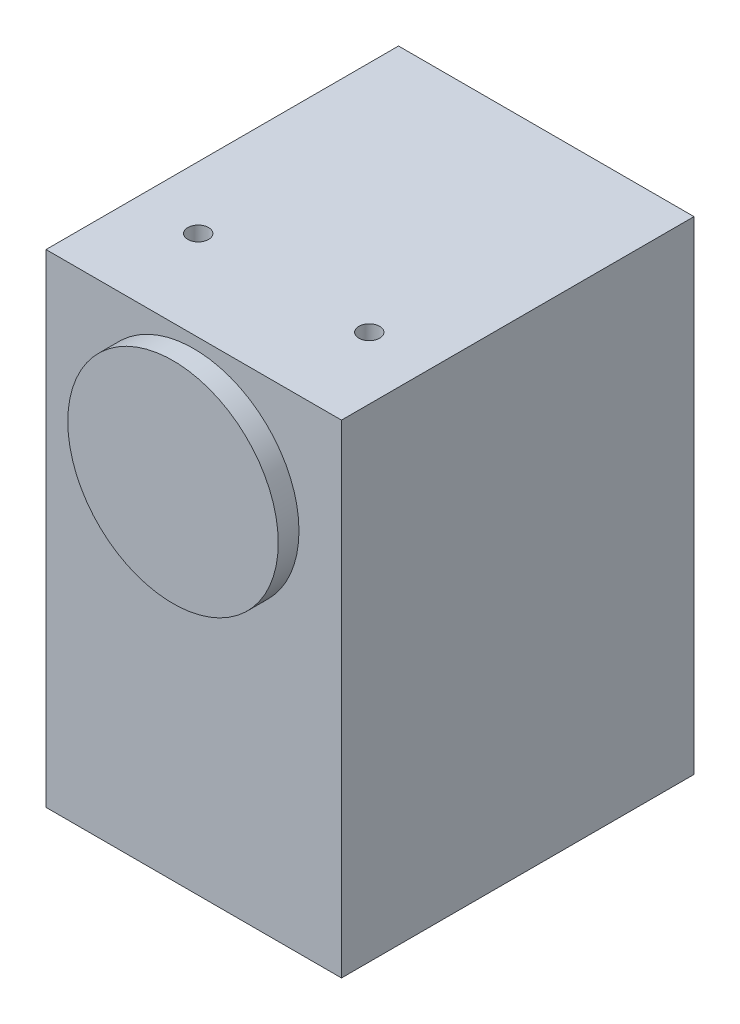
from build123d import *

# Parameters (mm, degrees)
ESQUISSE1_W             = 28.5
ESQUISSE1_H             = 46.6
BOSS_EXTRU_1_DEPTH      = 34
ESQUISSE2_R             = 10.15
BOSS_EXTRU_2_DEPTH      = 2
ESQUISSE3_R             = 1
ENL_V_MAT_EXTRU_1_DEPTH = 2


with BuildPart() as part:
    # Esquisse1 → Boss.-Extru.1 (new body)
    with BuildSketch(Plane.XY):
        Rectangle(ESQUISSE1_W, ESQUISSE1_H)
    extrude(amount=BOSS_EXTRU_1_DEPTH)

    # Esquisse2 → Boss.-Extru.2 (add)
    with BuildSketch(Plane.XY.offset(34)):
        with Locations((0, 12)):
            Circle(ESQUISSE2_R)
    extrude(amount=BOSS_EXTRU_2_DEPTH)

    # Esquisse3 → Enlèv. mat.-Extru.1 (cut)
    with BuildSketch(Plane(origin=(0, 23.3, 0), x_dir=(1, 0, 0), z_dir=(0, 1, 0))):
        with Locations(Location((-8.25, -25.319390083, 0), (0, 0, 270))):
            Circle(ESQUISSE3_R)
        with Locations(Location((8.25, -25.319390083, 0), (0, 0, 270))):
            Circle(ESQUISSE3_R)
    extrude(amount=-ENL_V_MAT_EXTRU_1_DEPTH, mode=Mode.SUBTRACT)


solid = part.part
